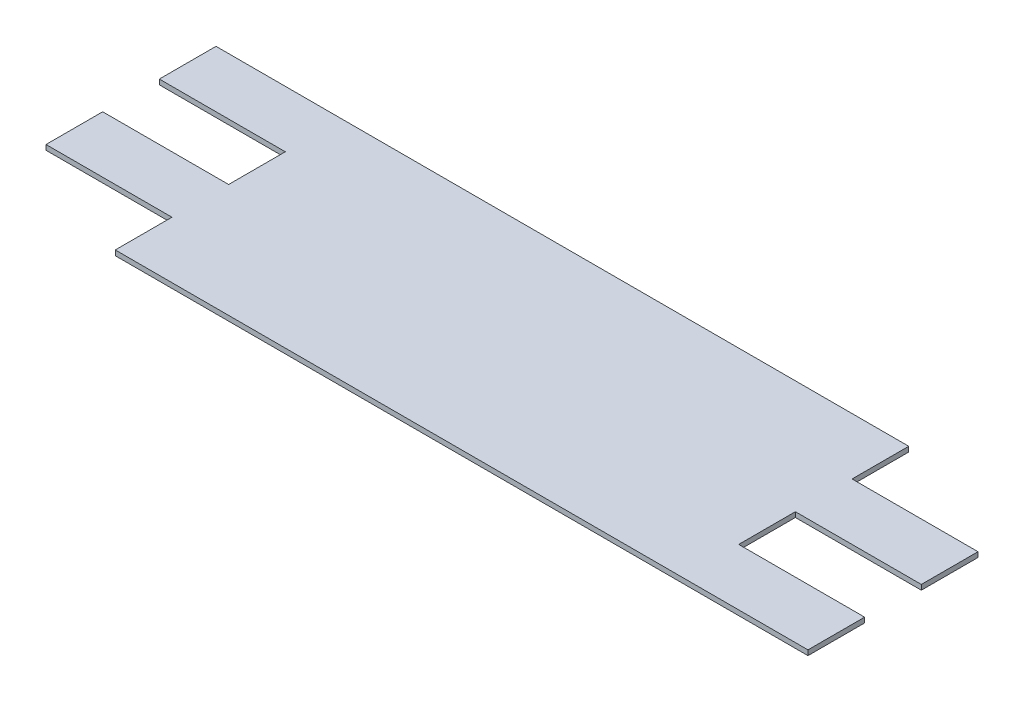
from build123d import *

# Parameters (mm, degrees)
BOSS_EXTRUDE1_DEPTH = 0.4


with BuildPart() as part:
    # Sketch1 → Boss-Extrude1 (new body)
    with BuildSketch(Plane(origin=(0, 0, 0), x_dir=(1, 0, 0), z_dir=(0, 1, 0))):
        Polygon((0, 0), (55, 0), (55, -4.5), (65, -4.5), (65, -9), (55, -9), (55, -13.5), (65, -13.5), (65, -18), (10, -18), (10, -13.5), (0, -13.5), (0, -9), (10, -9), (10, -4.5), (0, -4.5), align=None)
    extrude(amount=BOSS_EXTRUDE1_DEPTH)


solid = part.part
